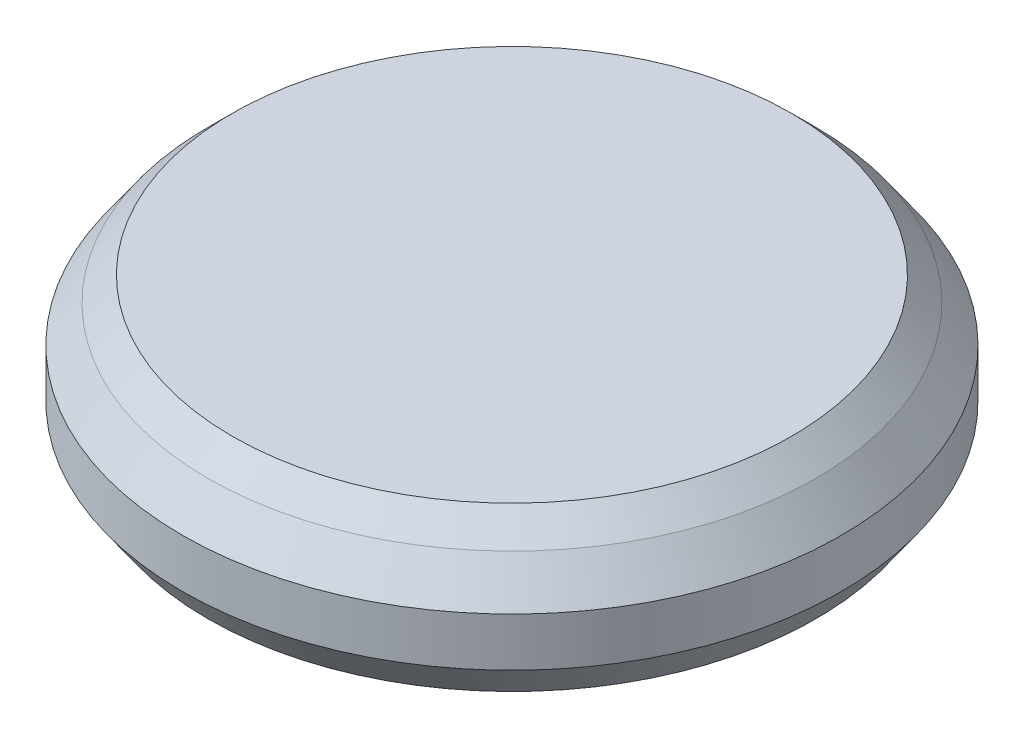
from build123d import *

# Parameters (mm, degrees)
CROQUIS1_R              = 25
SALIENTE_EXTRUIR1_DEPTH = 3
SALIENTE_EXTRUIR1_DRAFT = -35
CROQUIS2_R              = 27.100622615
SALIENTE_EXTRUIR2_DEPTH = 4
CROQUIS3_R              = 27.100622615
SALIENTE_EXTRUIR3_DEPTH = 3
SALIENTE_EXTRUIR3_TAPER = 35
CROQUIS4_R              = 25
SALIENTE_EXTRUIR4_DEPTH = 2
SALIENTE_EXTRUIR4_TAPER = 45


with BuildPart() as part:
    # Croquis1 → Saliente-Extruir1 (with draft: the straight prism first)
    with BuildSketch(Plane(origin=(0, 0, 0), x_dir=(1, 0, 0), z_dir=(0, 1, 0))):
        Circle(CROQUIS1_R)
    extrude(amount=SALIENTE_EXTRUIR1_DEPTH)
    # Saliente-Extruir1: the draft: its side faces are tilted about the plane it starts from
    saliente_extruir1_sides = [part.faces().sort_by_distance(p)[0] for p in [
        (-25, 1.5, 0),
    ]]
    draft(saliente_extruir1_sides, Plane(origin=(0, 0, 0), x_dir=(1, 0, 0), z_dir=(0, 1, 0)), SALIENTE_EXTRUIR1_DRAFT)

    # Croquis2 → Saliente-Extruir2 (add)
    with BuildSketch(Plane(origin=(0, 3, 0), x_dir=(1, 0, 0), z_dir=(0, 1, 0))):
        with Locations(Location((0, 0, 0), (0, 0, 270))):
            Circle(CROQUIS2_R)
    extrude(amount=SALIENTE_EXTRUIR2_DEPTH)

    # Croquis3 → Saliente-Extruir3 (add)
    with BuildSketch(Plane(origin=(0, 7, 0), x_dir=(1, 0, 0), z_dir=(0, 1, 0))):
        with Locations(Location((0, 0, 0), (0, 0, 270))):
            Circle(CROQUIS3_R)
    extrude(amount=SALIENTE_EXTRUIR3_DEPTH, taper=SALIENTE_EXTRUIR3_TAPER)


with BuildPart() as body_2:
    # Croquis4 → Saliente-Extruir4 (new body)
    with BuildSketch(Plane(origin=(0, 10, 0), x_dir=(1, 0, 0), z_dir=(0, 1, 0))):
        Circle(CROQUIS4_R)
    extrude(amount=SALIENTE_EXTRUIR4_DEPTH, taper=SALIENTE_EXTRUIR4_TAPER)


solid = Compound([part.part, body_2.part])
